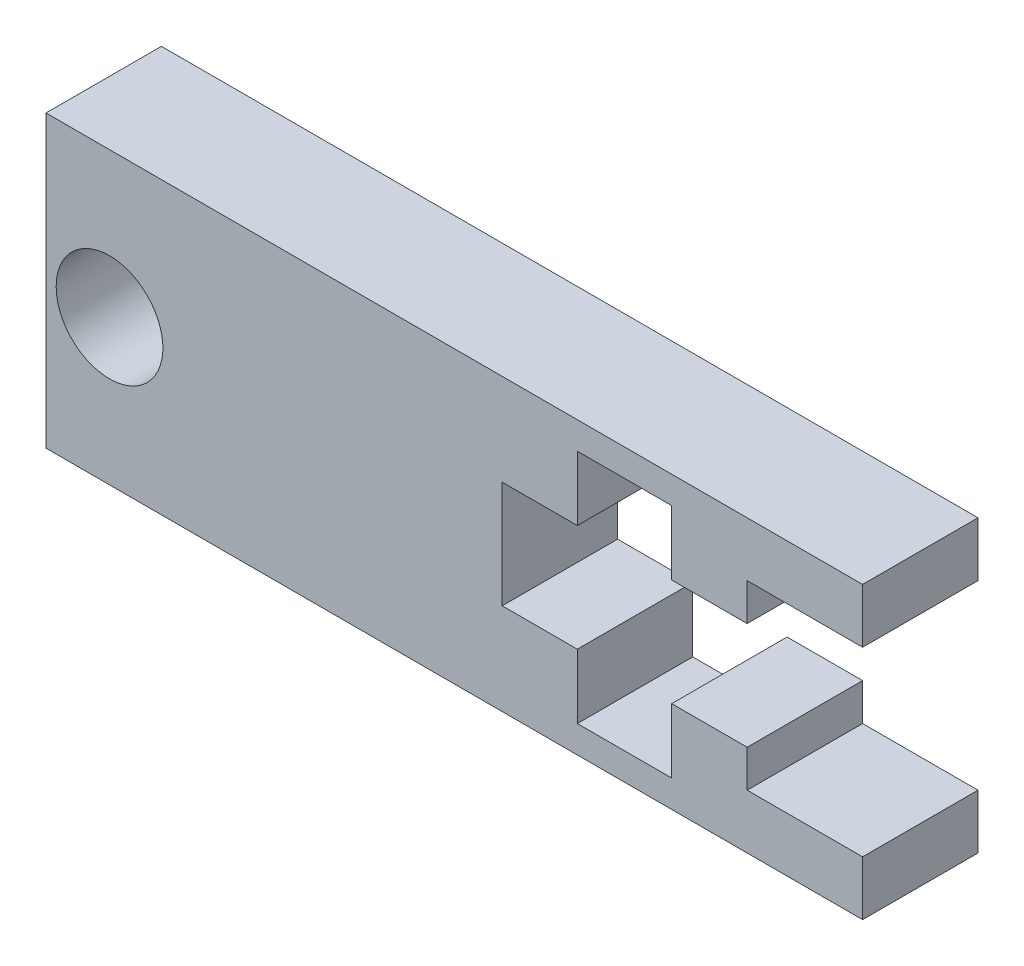
from build123d import *

# Parameters (mm, degrees)
SKETCH1_W           = 22.5
SKETCH1_H           = 8
SKETCH1_R           = 1.47
BOSS_EXTRUDE1_DEPTH = 1.59
CUT_EXTRUDE1_DEPTH  = 13.3561685


with BuildPart() as part:
    # Sketch1 → Boss-Extrude1 (new, symmetric)
    with BuildSketch(Plane.XY):
        Rectangle(SKETCH1_W, SKETCH1_H)
        with Locations(Location((-9.5, 0, 0), (0, 0, 180))):
            Circle(SKETCH1_R, mode=Mode.SUBTRACT)
    extrude(amount=BOSS_EXTRUDE1_DEPTH, both=True)

    # Sketch2 → Cut-Extrude1 (cut, through all)
    with BuildSketch(Plane(origin=(0, 0, -1.59), x_dir=(-1, 0, 0), z_dir=(0, 0, -1))):
        Polygon((-3.39, -1.475), (-1.32, -1.475), (-1.32, 1.475), (-3.39, 1.475), (-3.39, 3.25), (-5.99, 3.25), (-5.99, 1.475), (-8.07, 1.475), (-8.07, 2.5), (-11.25, 2.5), (-11.25, -2.5), (-8.07, -2.5), (-8.07, -1.475), (-5.99, -1.475), (-5.99, -3.25), (-3.39, -3.25), align=None)
    extrude(amount=-CUT_EXTRUDE1_DEPTH, mode=Mode.SUBTRACT)


solid = part.part
